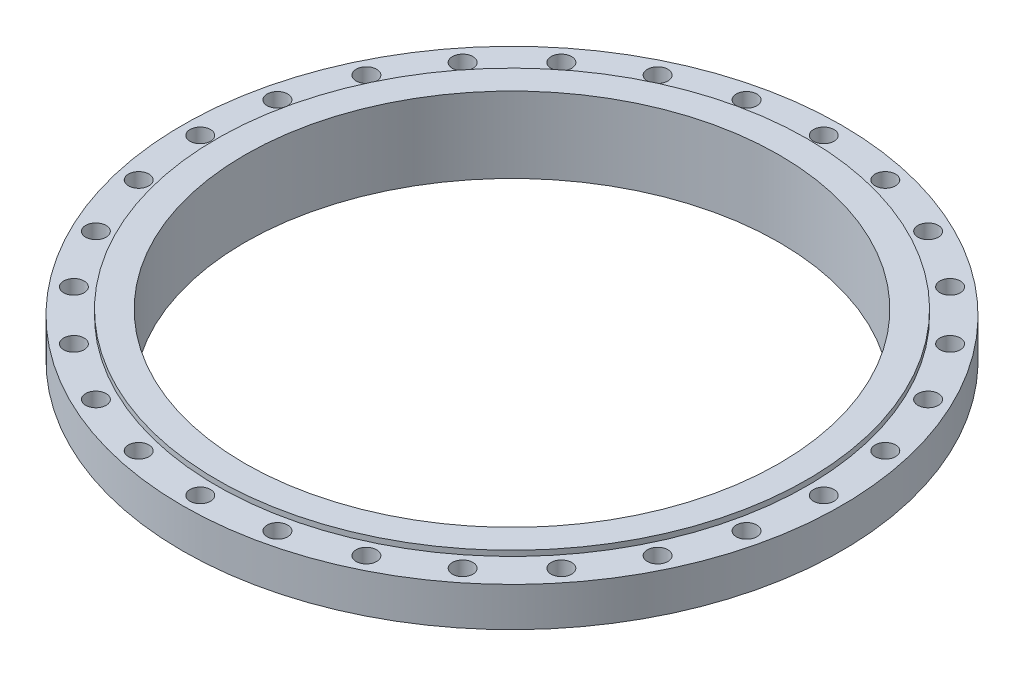
from build123d import *

# Parameters (mm, degrees)
SKETCH_2_R          = 11.5
CUT_EXTRUDE_1_DEPTH = 530.189002153
SKETCH1_R           = 300
CUT_EXTRUDE1_DEPTH  = 529.606659058


with BuildPart() as part:
    # Эскиз1 → Повернуть1 (revolve)
    with BuildSketch(Plane.XY):
        with BuildLine():
            Line((-300, 0), (-300, 35))
            Line((-300, 35), (0, 35))
            Line((0, 35), (0, 75))
            Line((0, 75), (-300, 75))
            Line((-300, 75), (-300, 85))
            Line((-300, 85), (-331.5, 85))
            Line((-331.5, 85), (-331.5, 79))
            Line((-331.5, 79), (-370, 79))
            Line((-370, 79), (-370, 35))
            Line((-370, 35), (-329, 35))
            ThreePointArc((-329, 35), (-324.931332644, 33.696134298), (-322.378378378, 30.27027027))
            Line((-322.378378378, 30.27027027), (-312, 0))
            Line((-312, 0), (-300, 0))
        make_face()
    revolve(axis=Axis((0, 0, 0), (0, 1, 0)))

    # Эскиз2 → Вырез-Вытянуть1 (cut, through all)
    with BuildSketch(Plane(origin=(0, 79, 0), x_dir=(1, 0, 0), z_dir=(0, 1, 0))):
        with Locations((0, 350)):
            Circle(SKETCH_2_R)
        with Locations((77.882326885, 341.224769264)):
            Circle(SKETCH_2_R)
        with Locations((151.859308691, 315.339103766)):
            Circle(SKETCH_2_R)
        with Locations((218.221430651, 273.641018864)):
            Circle(SKETCH_2_R)
        with Locations((273.641018864, 218.221430651)):
            Circle(SKETCH_2_R)
        with Locations((315.339103766, 151.859308691)):
            Circle(SKETCH_2_R)
        with Locations((341.224769264, 77.882326885)):
            Circle(SKETCH_2_R)
        with Locations((350, 0)):
            Circle(SKETCH_2_R)
        with Locations((341.224769264, -77.882326885)):
            Circle(SKETCH_2_R)
        with Locations((315.339103766, -151.859308691)):
            Circle(SKETCH_2_R)
        with Locations((273.641018864, -218.221430651)):
            Circle(SKETCH_2_R)
        with Locations((218.221430651, -273.641018864)):
            Circle(SKETCH_2_R)
        with Locations((151.859308691, -315.339103766)):
            Circle(SKETCH_2_R)
        with Locations((77.882326885, -341.224769264)):
            Circle(SKETCH_2_R)
        with Locations((0, -350)):
            Circle(SKETCH_2_R)
        with Locations((-77.882326885, -341.224769264)):
            Circle(SKETCH_2_R)
        with Locations((-151.859308691, -315.339103766)):
            Circle(SKETCH_2_R)
        with Locations((-218.221430651, -273.641018864)):
            Circle(SKETCH_2_R)
        with Locations((-273.641018864, -218.221430651)):
            Circle(SKETCH_2_R)
        with Locations((-315.339103766, -151.859308691)):
            Circle(SKETCH_2_R)
        with Locations((-341.224769264, -77.882326885)):
            Circle(SKETCH_2_R)
        with Locations((-350, 0)):
            Circle(SKETCH_2_R)
        with Locations((-341.224769264, 77.882326885)):
            Circle(SKETCH_2_R)
        with Locations((-315.339103766, 151.859308691)):
            Circle(SKETCH_2_R)
        with Locations((-273.641018864, 218.221430651)):
            Circle(SKETCH_2_R)
        with Locations((-218.221430651, 273.641018864)):
            Circle(SKETCH_2_R)
        with Locations((-151.859308691, 315.339103766)):
            Circle(SKETCH_2_R)
        with Locations((-77.882326885, 341.224769264)):
            Circle(SKETCH_2_R)
    extrude(amount=-CUT_EXTRUDE_1_DEPTH, mode=Mode.SUBTRACT)

    # Sketch1 → Cut-Extrude1 (cut, through all)
    with BuildSketch(Plane(origin=(0, 75, 0), x_dir=(1, 0, 0), z_dir=(0, 1, 0))):
        Circle(SKETCH1_R)
    extrude(amount=-CUT_EXTRUDE1_DEPTH, mode=Mode.SUBTRACT)


solid = part.part
